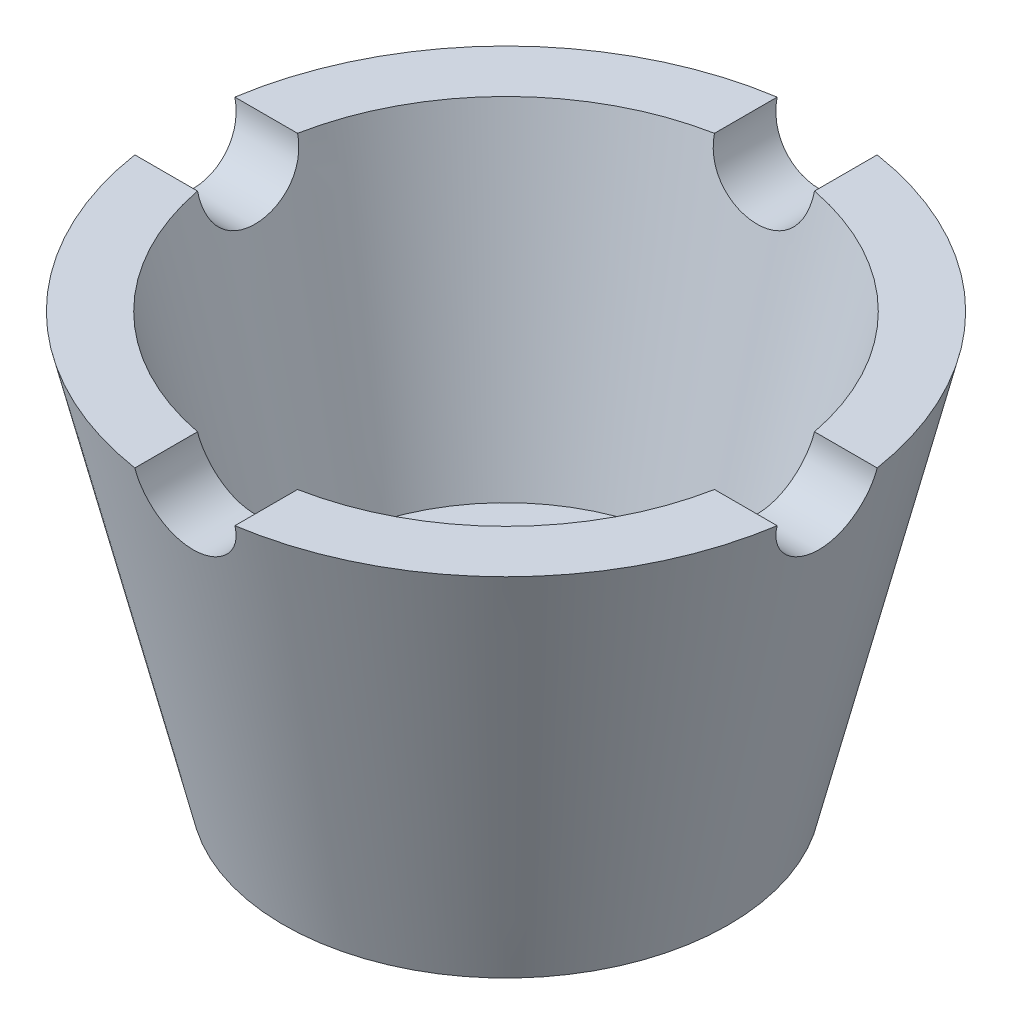
from build123d import *

# Parameters (mm, degrees)
SKETCH3_R          = 5
CUT_EXTRUDE1_DEPTH = 63.261545114
CIRPATTERN1_COUNT  = 4


with BuildPart() as part:
    # Sketch2 → Revolve1 (revolve)
    with BuildSketch(Plane.XY, mode=Mode.PRIVATE) as revolve1_sk:
        Polygon((11.25, 0), (11.25, 12), (19, 12), (26.323794171, 42), (32.5, 42), (22.246688161, 0), align=None)
    revolve(revolve1_sk.sketch.rotate(Axis((0, 0, 0), (0, 1, 0)), 90), axis=Axis((0, 0, 0), (0, 1, 0)))

    # Sketch3 → Cut-Extrude1 (cut, symmetric)
    with BuildSketch(Plane.XY):
        with Locations((0, 42)):
            Circle(SKETCH3_R)
    cut_extrude1 = extrude(amount=CUT_EXTRUDE1_DEPTH, both=True, mode=Mode.SUBTRACT)

    # CirPattern1: Cut-Extrude1 ×4 about axis
    cirpattern1_axis = Axis((0, 0, 0), (0, -1, 0))
    for i in range(1, CIRPATTERN1_COUNT):
        add(cut_extrude1.rotate(cirpattern1_axis, i * 360 / CIRPATTERN1_COUNT), mode=Mode.SUBTRACT)


solid = part.part
